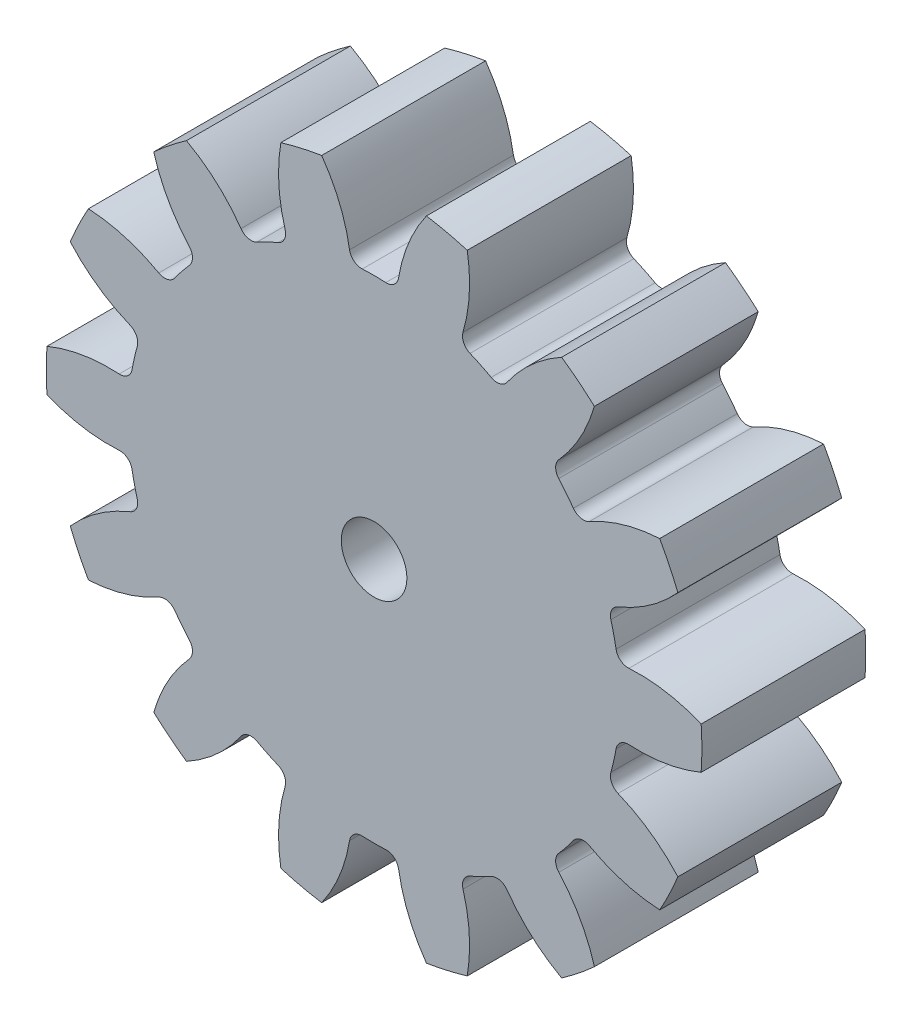
from build123d import *

# Parameters (mm, degrees)
SKETCH1_R                = 10
BOSS_EXTRUDE1_DEPTH      = 2.5
CUT_EXTRUDE1_DEPTH       = 15.361406616
FILLET2_R                = 0.375
CIRPATTERN1_COUNT        = 14
FILLET2_OF_CIRPATTERN1_R = 0.375
SKETCH4_R                = 1
CUT_EXTRUDE2_DEPTH       = 15.914645257


with BuildPart() as part:
    # Sketch1 → Boss-Extrude1 (new, symmetric)
    with BuildSketch(Plane.XY):
        Circle(SKETCH1_R)
    extrude(amount=BOSS_EXTRUDE1_DEPTH, both=True)

    # Sketch3 → Cut-Extrude1 (cut, symmetric)
    with BuildSketch(Plane.XY):
        with BuildLine():
            ThreePointArc((-2.384983441, 10.738335718), (-1.22868019, 9.264795525), (-0.703171547, 7.466963893))
            ThreePointArc((-0.703171547, 7.466963893), (0, 7.5), (0.703171547, 7.466963893))
            ThreePointArc((0.703171547, 7.466963893), (1.22868019, 9.264795525), (2.384983441, 10.738335718))
            ThreePointArc((2.384983441, 10.738335718), (0, 11), (-2.384983441, 10.738335718))
        make_face()
    cut_extrude1 = extrude(amount=CUT_EXTRUDE1_DEPTH, both=True, mode=Mode.SUBTRACT)

    # Fillet2
    fillet2_edges = [part.edges().sort_by_distance(p)[0] for p in [
        (-0.703171547, 7.466963893, 0),
        (0.703171547, 7.466963893, 0),
    ]]
    fillet(fillet2_edges, radius=FILLET2_R)

    # CirPattern1: Cut-Extrude1 ×14 about axis
    cirpattern1_axis = Axis((0, 0, 0), (0, 0, 1))
    for i in range(1, CIRPATTERN1_COUNT):
        add(cut_extrude1.rotate(cirpattern1_axis, i * 360 / CIRPATTERN1_COUNT), mode=Mode.SUBTRACT)

    # Fillet2 of CirPattern1
    fillet2_of_cirpattern1_edges = [part.edges().sort_by_distance(p)[0] for p in [
        (-3.873329886, 6.422407305, 0),
        (-2.606258541, 7.032596705, 0),
        (-6.276327738, 4.105814185, 0),
        (-5.399487161, 5.205337491, 0),
        (-7.436221908, 0.976014211, 0),
        (-7.123281129, 2.347097347, 0),
        (-7.123281129, -2.347097347, 0),
        (-7.436221908, -0.976014211, 0),
        (-5.399487161, -5.205337491, 0),
        (-6.276327738, -4.105814185, 0),
        (-2.606258541, -7.032596705, 0),
        (-3.873329886, -6.422407305, 0),
        (0.703171547, -7.466963893, 0),
        (-0.703171547, -7.466963893, 0),
        (3.873329886, -6.422407305, 0),
        (2.606258541, -7.032596705, 0),
        (6.276327738, -4.105814185, 0),
        (5.399487161, -5.205337491, 0),
        (7.436221908, -0.976014211, 0),
        (7.123281129, -2.347097347, 0),
        (7.123281129, 2.347097347, 0),
        (7.436221908, 0.976014211, 0),
        (5.399487161, 5.205337491, 0),
        (6.276327738, 4.105814185, 0),
        (2.606258541, 7.032596705, 0),
        (3.873329886, 6.422407305, 0),
    ]]
    fillet(fillet2_of_cirpattern1_edges, radius=FILLET2_OF_CIRPATTERN1_R)

    # Sketch4 → Cut-Extrude2 (cut, through all)
    with BuildSketch(Plane(origin=(0, 0, -2.5), x_dir=(-1, 0, 0), z_dir=(0, 0, -1))):
        Circle(SKETCH4_R)
    extrude(amount=-CUT_EXTRUDE2_DEPTH, mode=Mode.SUBTRACT)


solid = part.part
